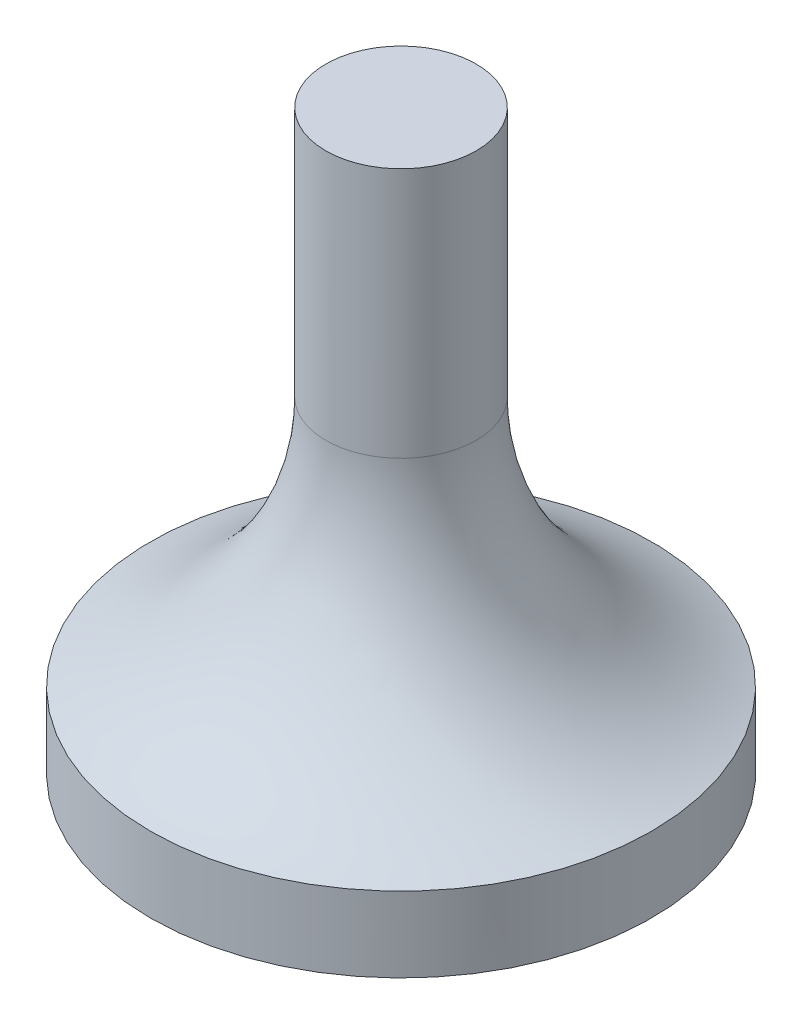
from build123d import *

# Parameters (mm, degrees)
SKETCH_1_R      = 10
EXTRUDE_1_DEPTH = 3
SKETCH_2_R      = 3
EXTRUDE_2_DEPTH = 20


with BuildPart() as part:
    # 草图1 → 凸台-拉伸1 (new body)
    with BuildSketch(Plane(origin=(0, 0, 0), x_dir=(1, 0, 0), z_dir=(0, 1, 0))):
        with Locations(Location((0, 0, 0), (0, 0, 270))):
            Circle(SKETCH_1_R)
    extrude(amount=EXTRUDE_1_DEPTH)

    # 草图2 → 凸台-拉伸2 (add)
    with BuildSketch(Plane(origin=(0, 3, 0), x_dir=(1, 0, 0), z_dir=(0, 1, 0))):
        with Locations(Location((0, 0, 0), (0, 0, 270))):
            Circle(SKETCH_2_R)
    extrude(amount=EXTRUDE_2_DEPTH)

    # 草图3 → 旋转2 (revolve)
    with BuildSketch(Plane.XY, mode=Mode.PRIVATE) as revolve_2_sk:
        with BuildLine():
            Line((-10, 3), (-3, 3))
            Line((-3, 3), (-3, 13))
            ThreePointArc((-3, 13), (-4.923888846, 6.896722192), (-10, 3))
        make_face()
    revolve(revolve_2_sk.sketch.rotate(Axis((0, -1000, 0), (0, 1, 0)), 180), axis=Axis((0, -1000, 0), (0, 1, 0)))


solid = part.part
